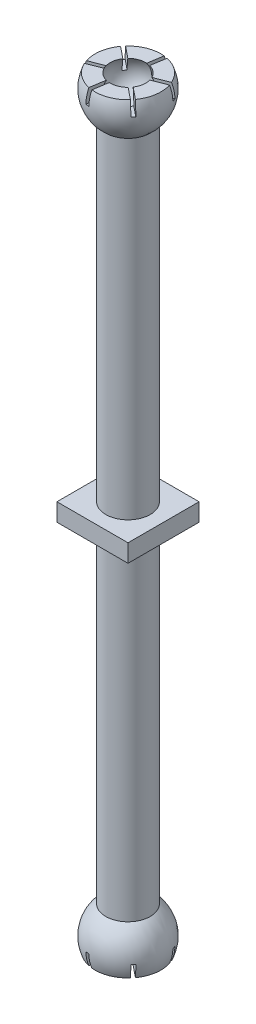
from build123d import *

# Parameters (mm, degrees)
SKETCH1_R           = 25
BOSS_EXTRUDE1_DEPTH = 413
SKETCH4_R           = 49.294664067
CUT_EXTRUDE1_DEPTH  = 883.814249998
SKETCH5_R           = 48.080679196
CUT_EXTRUDE2_DEPTH  = 883.814249998
CUT_EXTRUDE3_DEPTH  = 868.845608389
CUT_EXTRUDE4_DEPTH  = 843.900349982
SKETCH10_W          = 80
SKETCH10_H          = 80
BOSS_EXTRUDE2_DEPTH = 10


with BuildPart() as part:
    # Sketch1 → Boss-Extrude1 (new, symmetric)
    with BuildSketch(Plane(origin=(0, 0, 0), x_dir=(1, 0, 0), z_dir=(0, 1, 0))):
        with Locations(Location((0, 0, 0), (0, 0, 90))):
            Circle(SKETCH1_R)
    extrude(amount=BOSS_EXTRUDE1_DEPTH, both=True)

    # Sketch2 → Revolve1 (revolve)
    with BuildSketch(Plane.XZ.offset(413)):
        with BuildLine():
            Line((0, 40), (0, -40))
            ThreePointArc((0, -40), (-40, 0), (0, 40))
        make_face()
    revolve(axis=Axis((0, -413, 40), (0, 0, -1)))

    # Sketch3 → Revolve2 (revolve)
    with BuildSketch(Plane(origin=(0, 413, 0), x_dir=(1, 0, 0), z_dir=(0, 1, 0))):
        with BuildLine():
            Line((0, 40), (0, -40))
            ThreePointArc((0, -40), (-40, 0), (0, 40))
        make_face()
    revolve(axis=Axis((0, 413, -40), (0, 0, 1)))

    # Sketch4 → Cut-Extrude1 (cut, through all)
    with BuildSketch(Plane(origin=(0, 428, 0), x_dir=(1, 0, 0), z_dir=(0, 1, 0))):
        Circle(SKETCH4_R)
    extrude(amount=CUT_EXTRUDE1_DEPTH, mode=Mode.SUBTRACT)

    # Sketch5 → Cut-Extrude2 (cut, through all)
    with BuildSketch(Plane(origin=(0, -428, 0), x_dir=(-1, 0, 0), z_dir=(0, -1, 0))):
        Circle(SKETCH5_R)
    extrude(amount=CUT_EXTRUDE2_DEPTH, mode=Mode.SUBTRACT)

    # Sketch6 → Cut-Revolve1 (revolve, cut)
    with BuildSketch(Plane(origin=(0, -413, 0), x_dir=(-1, 0, 0), z_dir=(0, -1, 0))):
        with BuildLine():
            Line((13.166254752, 21.252052508), (-13.166254752, -21.252052508))
            ThreePointArc((-13.166254752, -21.252052508), (-21.252052508, 13.166254752), (13.166254752, 21.252052508))
        make_face()
    revolve(axis=Axis((-13.166254752, -413, -21.252052508), (0.5266501900936162, 0, 0.8500821003140566)), mode=Mode.SUBTRACT)

    # Sketch7 → Cut-Extrude3 (cut, through all)
    with BuildSketch(Plane(origin=(0, -413, 0), x_dir=(-1, 0, 0), z_dir=(0, -1, 0))):
        with BuildLine():
            Line((-3.951653906, -0.620025326), (-40.858656231, 13.608501143))
            ThreePointArc((-40.858656231, 13.608501143), (-40.18257737, 15.491338491), (-39.419786961, 17.340746476))
            Line((-39.419786961, 17.340746476), (-2.512784636, 3.112220007))
            Line((-2.512784636, 3.112220007), (-8.644020418, 42.188884832))
            ThreePointArc((-8.644020418, 42.188884832), (-6.675396014, 42.544802038), (-4.692366512, 42.808910158))
            Line((-4.692366512, 42.808910158), (1.43886927, 3.732245333))
            Line((1.43886927, 3.732245333), (32.214635813, 28.580383689))
            ThreePointArc((32.214635813, 28.580383689), (33.507181357, 27.053463547), (34.727420449, 25.468163682))
            Line((34.727420449, 25.468163682), (3.951653906, 0.620025326))
            Line((3.951653906, 0.620025326), (40.858656231, -13.608501143))
            ThreePointArc((40.858656231, -13.608501143), (40.18257737, -15.491338491), (39.419786961, -17.340746476))
            Line((39.419786961, -17.340746476), (2.512784636, -3.112220007))
            Line((2.512784636, -3.112220007), (8.644020418, -42.188884832))
            ThreePointArc((8.644020418, -42.188884832), (6.675396014, -42.544802038), (4.692366512, -42.808910158))
            Line((4.692366512, -42.808910158), (-1.43886927, -3.732245333))
            Line((-1.43886927, -3.732245333), (-32.214635813, -28.580383689))
            ThreePointArc((-32.214635813, -28.580383689), (-33.507181357, -27.053463547), (-34.727420449, -25.468163682))
            Line((-34.727420449, -25.468163682), (-3.951653906, -0.620025326))
        make_face()
    extrude(amount=CUT_EXTRUDE3_DEPTH, mode=Mode.SUBTRACT)

    # Sketch8 → Cut-Revolve2 (revolve, cut)
    with BuildSketch(Plane(origin=(0, 413, 0), x_dir=(1, 0, 0), z_dir=(0, 1, 0))):
        with BuildLine():
            Line((15.032482858, 19.97559659), (-15.032482858, -19.97559659))
            ThreePointArc((-15.032482858, -19.97559659), (-19.97559659, 15.032482858), (15.032482858, 19.97559659))
        make_face()
    revolve(axis=Axis((15.032482858, 413, -19.97559659), (-0.6012993143075083, 0, 0.7990238636069141)), mode=Mode.SUBTRACT)

    # Sketch9 → Cut-Extrude4 (cut, through all)
    with BuildSketch(Plane(origin=(0, 413, 0), x_dir=(1, 0, 0), z_dir=(0, 1, 0))):
        with BuildLine():
            Line((3.951653906, -0.620025326), (40.858656231, 13.608501143))
            ThreePointArc((40.858656231, 13.608501143), (40.18257737, 15.491338491), (39.419786961, 17.340746476))
            Line((39.419786961, 17.340746476), (2.512784636, 3.112220007))
            Line((2.512784636, 3.112220007), (8.644020418, 42.188884832))
            ThreePointArc((8.644020418, 42.188884832), (6.675396014, 42.544802038), (4.692366512, 42.808910158))
            Line((4.692366512, 42.808910158), (-1.43886927, 3.732245333))
            Line((-1.43886927, 3.732245333), (-32.214635813, 28.580383689))
            ThreePointArc((-32.214635813, 28.580383689), (-33.507181357, 27.053463547), (-34.727420449, 25.468163682))
            Line((-34.727420449, 25.468163682), (-3.951653906, 0.620025326))
            Line((-3.951653906, 0.620025326), (-40.858656231, -13.608501143))
            ThreePointArc((-40.858656231, -13.608501143), (-40.18257737, -15.491338491), (-39.419786961, -17.340746476))
            Line((-39.419786961, -17.340746476), (-2.512784636, -3.112220007))
            Line((-2.512784636, -3.112220007), (-8.644020418, -42.188884832))
            ThreePointArc((-8.644020418, -42.188884832), (-6.675396014, -42.544802038), (-4.692366512, -42.808910158))
            Line((-4.692366512, -42.808910158), (1.43886927, -3.732245333))
            Line((1.43886927, -3.732245333), (32.214635813, -28.580383689))
            ThreePointArc((32.214635813, -28.580383689), (33.507181357, -27.053463547), (34.727420449, -25.468163682))
            Line((34.727420449, -25.468163682), (3.951653906, -0.620025326))
        make_face()
    extrude(amount=CUT_EXTRUDE4_DEPTH, mode=Mode.SUBTRACT)

    # Sketch10 → Boss-Extrude2 (add, symmetric)
    with BuildSketch(Plane(origin=(0, 0, 0), x_dir=(1, 0, 0), z_dir=(0, 1, 0))):
        Rectangle(SKETCH10_W, SKETCH10_H)
    extrude(amount=BOSS_EXTRUDE2_DEPTH, both=True)


solid = part.part
